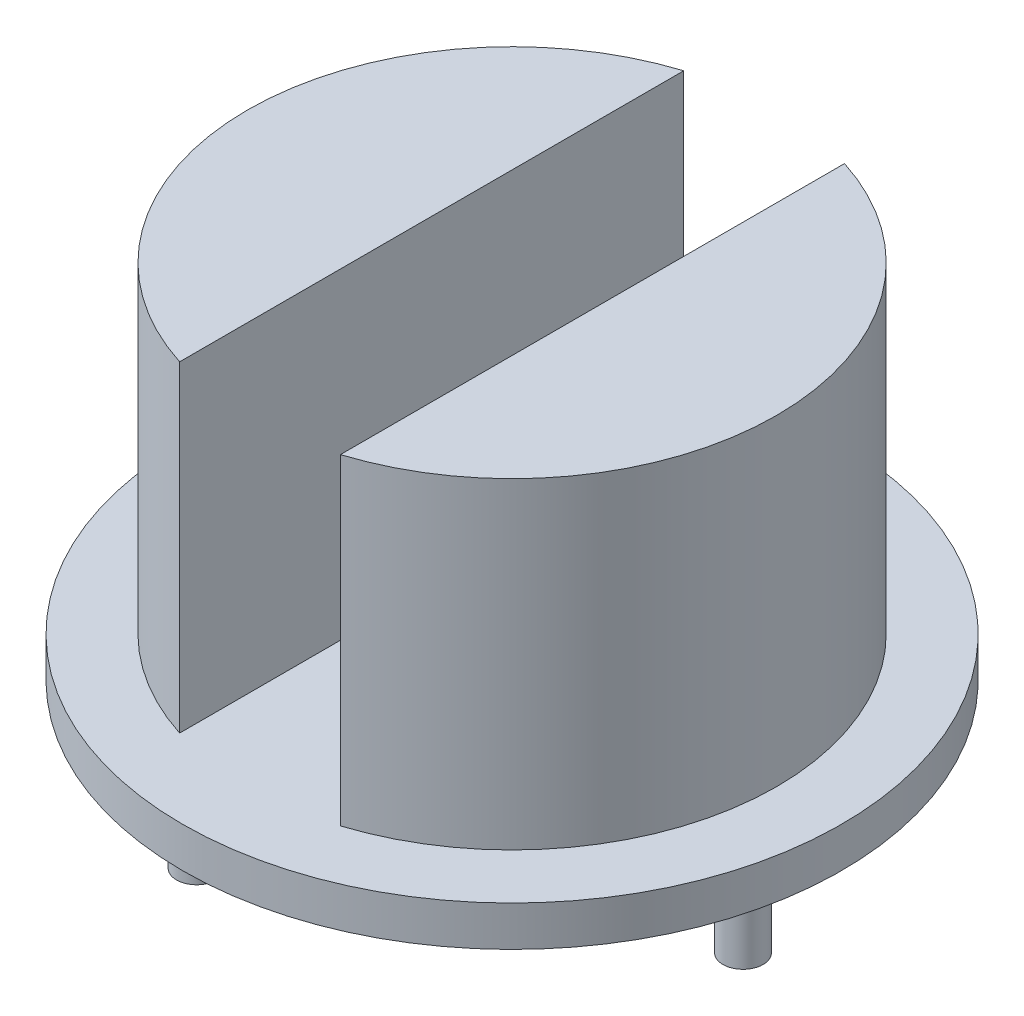
from build123d import *

# Parameters (mm, degrees)
SKETCH1_R           = 41
BOSS_EXTRUDE1_DEPTH = 5
SKETCH2_R           = 2.5
BOSS_EXTRUDE2_DEPTH = 15
BOSS_EXTRUDE3_DEPTH = 40


with BuildPart() as part:
    # Sketch1 → Boss-Extrude1 (new body)
    with BuildSketch(Plane(origin=(0, 0, 0), x_dir=(1, 0, 0), z_dir=(0, 1, 0))):
        with Locations(Location((0, 0, 0), (0, 0, 270))):
            Circle(SKETCH1_R)
    extrude(amount=BOSS_EXTRUDE1_DEPTH)

    # Sketch2 → Boss-Extrude2 (add)
    with BuildSketch(Plane.XZ):
        with Locations(Location((28.730078072, 0, 0), (0, 0, 90))):
            Circle(SKETCH2_R)
        with Locations(Location((-14.365, 24.881, 0), (0, 0, 90))):
            Circle(SKETCH2_R)
        with Locations(Location((-14.365, -24.881, 0), (0, 0, 90))):
            Circle(SKETCH2_R)
    extrude(amount=BOSS_EXTRUDE2_DEPTH)

    # Sketch3 → Boss-Extrude3 (add)
    with BuildSketch(Plane(origin=(0, 5, 0), x_dir=(1, 0, 0), z_dir=(0, 1, 0))):
        with BuildLine():
            Line((-10, 31.356159261), (-10, -31.356159261))
            ThreePointArc((-10, -31.356159261), (-32.912136418, 0), (-10, 31.356159261))
        make_face()
        with BuildLine():
            Line((10, 31.356159261), (10, -31.356159261))
            ThreePointArc((10, -31.356159261), (32.912136418, 0), (10, 31.356159261))
        make_face()
    extrude(amount=BOSS_EXTRUDE3_DEPTH)


solid = part.part
